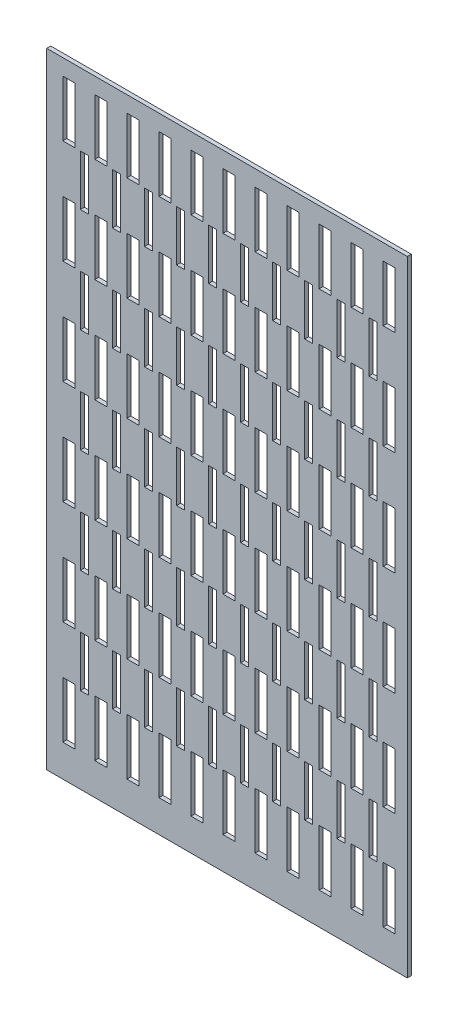
from build123d import *

# Parameters (mm, degrees)
SKETCH_1_W          = 45
SKETCH_1_H          = 78
EXTRUDE_1_DEPTH     = 0.5
SKETCH_2_W          = 1.5
SKETCH_2_H          = 7
SKETCH_2_W_2        = 1
SKETCH_2_H_2        = 6.326302659
CUT_EXTRUDE_1_DEPTH = 0.5


with BuildPart() as part:
    # 草图1 → 凸台-拉伸1 (new body)
    with BuildSketch(Plane.XY):
        with Locations((0, 39)):
            Rectangle(SKETCH_1_W, SKETCH_1_H)
    extrude(amount=EXTRUDE_1_DEPTH)

    # 草图2 → 切除-拉伸1 (cut)
    with BuildSketch(Plane.XY.offset(0.5)):
        with Locations((-19.75, 72.5)):
            Rectangle(SKETCH_2_W, SKETCH_2_H)
        with Locations((-15.75, 72.5)):
            Rectangle(SKETCH_2_W, SKETCH_2_H)
        with Locations((-11.75, 72.5)):
            Rectangle(SKETCH_2_W, SKETCH_2_H)
        with Locations((-7.75, 72.5)):
            Rectangle(SKETCH_2_W, SKETCH_2_H)
        with Locations((-3.75, 72.5)):
            Rectangle(SKETCH_2_W, SKETCH_2_H)
        with Locations((0.25, 72.5)):
            Rectangle(SKETCH_2_W, SKETCH_2_H)
        with Locations((4.25, 72.5)):
            Rectangle(SKETCH_2_W, SKETCH_2_H)
        with Locations((8.25, 72.5)):
            Rectangle(SKETCH_2_W, SKETCH_2_H)
        with Locations((12.25, 72.5)):
            Rectangle(SKETCH_2_W, SKETCH_2_H)
        with Locations((16.25, 72.5)):
            Rectangle(SKETCH_2_W, SKETCH_2_H)
        with Locations((20.25, 72.5)):
            Rectangle(SKETCH_2_W, SKETCH_2_H)
        with Locations((-19.75, 59.5)):
            Rectangle(SKETCH_2_W, SKETCH_2_H)
        with Locations((-15.75, 59.5)):
            Rectangle(SKETCH_2_W, SKETCH_2_H)
        with Locations((-11.75, 59.5)):
            Rectangle(SKETCH_2_W, SKETCH_2_H)
        with Locations((-7.75, 59.5)):
            Rectangle(SKETCH_2_W, SKETCH_2_H)
        with Locations((-3.75, 59.5)):
            Rectangle(SKETCH_2_W, SKETCH_2_H)
        with Locations((0.25, 59.5)):
            Rectangle(SKETCH_2_W, SKETCH_2_H)
        with Locations((4.25, 59.5)):
            Rectangle(SKETCH_2_W, SKETCH_2_H)
        with Locations((8.25, 59.5)):
            Rectangle(SKETCH_2_W, SKETCH_2_H)
        with Locations((12.25, 59.5)):
            Rectangle(SKETCH_2_W, SKETCH_2_H)
        with Locations((16.25, 59.5)):
            Rectangle(SKETCH_2_W, SKETCH_2_H)
        with Locations((20.25, 59.5)):
            Rectangle(SKETCH_2_W, SKETCH_2_H)
        with Locations((-19.75, 46.5)):
            Rectangle(SKETCH_2_W, SKETCH_2_H)
        with Locations((-15.75, 46.5)):
            Rectangle(SKETCH_2_W, SKETCH_2_H)
        with Locations((-11.75, 46.5)):
            Rectangle(SKETCH_2_W, SKETCH_2_H)
        with Locations((-7.75, 46.5)):
            Rectangle(SKETCH_2_W, SKETCH_2_H)
        with Locations((-3.75, 46.5)):
            Rectangle(SKETCH_2_W, SKETCH_2_H)
        with Locations((0.25, 46.5)):
            Rectangle(SKETCH_2_W, SKETCH_2_H)
        with Locations((4.25, 46.5)):
            Rectangle(SKETCH_2_W, SKETCH_2_H)
        with Locations((8.25, 46.5)):
            Rectangle(SKETCH_2_W, SKETCH_2_H)
        with Locations((12.25, 46.5)):
            Rectangle(SKETCH_2_W, SKETCH_2_H)
        with Locations((16.25, 46.5)):
            Rectangle(SKETCH_2_W, SKETCH_2_H)
        with Locations((20.25, 46.5)):
            Rectangle(SKETCH_2_W, SKETCH_2_H)
        with Locations((-19.75, 33.5)):
            Rectangle(SKETCH_2_W, SKETCH_2_H)
        with Locations((-15.75, 33.5)):
            Rectangle(SKETCH_2_W, SKETCH_2_H)
        with Locations((-11.75, 33.5)):
            Rectangle(SKETCH_2_W, SKETCH_2_H)
        with Locations((-7.75, 33.5)):
            Rectangle(SKETCH_2_W, SKETCH_2_H)
        with Locations((-3.75, 33.5)):
            Rectangle(SKETCH_2_W, SKETCH_2_H)
        with Locations((0.25, 33.5)):
            Rectangle(SKETCH_2_W, SKETCH_2_H)
        with Locations((4.25, 33.5)):
            Rectangle(SKETCH_2_W, SKETCH_2_H)
        with Locations((8.25, 33.5)):
            Rectangle(SKETCH_2_W, SKETCH_2_H)
        with Locations((12.25, 33.5)):
            Rectangle(SKETCH_2_W, SKETCH_2_H)
        with Locations((16.25, 33.5)):
            Rectangle(SKETCH_2_W, SKETCH_2_H)
        with Locations((20.25, 33.5)):
            Rectangle(SKETCH_2_W, SKETCH_2_H)
        with Locations((-19.75, 20.5)):
            Rectangle(SKETCH_2_W, SKETCH_2_H)
        with Locations((-15.75, 20.5)):
            Rectangle(SKETCH_2_W, SKETCH_2_H)
        with Locations((-11.75, 20.5)):
            Rectangle(SKETCH_2_W, SKETCH_2_H)
        with Locations((-7.75, 20.5)):
            Rectangle(SKETCH_2_W, SKETCH_2_H)
        with Locations((-3.75, 20.5)):
            Rectangle(SKETCH_2_W, SKETCH_2_H)
        with Locations((0.25, 20.5)):
            Rectangle(SKETCH_2_W, SKETCH_2_H)
        with Locations((4.25, 20.5)):
            Rectangle(SKETCH_2_W, SKETCH_2_H)
        with Locations((8.25, 20.5)):
            Rectangle(SKETCH_2_W, SKETCH_2_H)
        with Locations((12.25, 20.5)):
            Rectangle(SKETCH_2_W, SKETCH_2_H)
        with Locations((16.25, 20.5)):
            Rectangle(SKETCH_2_W, SKETCH_2_H)
        with Locations((20.25, 20.5)):
            Rectangle(SKETCH_2_W, SKETCH_2_H)
        with Locations((-19.75, 7.5)):
            Rectangle(SKETCH_2_W, SKETCH_2_H)
        with Locations((-15.75, 7.5)):
            Rectangle(SKETCH_2_W, SKETCH_2_H)
        with Locations((-11.75, 7.5)):
            Rectangle(SKETCH_2_W, SKETCH_2_H)
        with Locations((-7.75, 7.5)):
            Rectangle(SKETCH_2_W, SKETCH_2_H)
        with Locations((-3.75, 7.5)):
            Rectangle(SKETCH_2_W, SKETCH_2_H)
        with Locations((0.25, 7.5)):
            Rectangle(SKETCH_2_W, SKETCH_2_H)
        with Locations((4.25, 7.5)):
            Rectangle(SKETCH_2_W, SKETCH_2_H)
        with Locations((8.25, 7.5)):
            Rectangle(SKETCH_2_W, SKETCH_2_H)
        with Locations((12.25, 7.5)):
            Rectangle(SKETCH_2_W, SKETCH_2_H)
        with Locations((16.25, 7.5)):
            Rectangle(SKETCH_2_W, SKETCH_2_H)
        with Locations((20.25, 7.5)):
            Rectangle(SKETCH_2_W, SKETCH_2_H)
        with Locations((-13.8, 65.836848671)):
            Rectangle(SKETCH_2_W_2, SKETCH_2_H_2)
        with Locations((-17.8, 65.836848671)):
            Rectangle(SKETCH_2_W_2, SKETCH_2_H_2)
        with Locations((-9.8, 65.836848671)):
            Rectangle(SKETCH_2_W_2, SKETCH_2_H_2)
        with Locations((-5.8, 65.836848671)):
            Rectangle(SKETCH_2_W_2, SKETCH_2_H_2)
        with Locations((-1.8, 65.836848671)):
            Rectangle(SKETCH_2_W_2, SKETCH_2_H_2)
        with Locations((2.2, 65.836848671)):
            Rectangle(SKETCH_2_W_2, SKETCH_2_H_2)
        with Locations((6.2, 65.836848671)):
            Rectangle(SKETCH_2_W_2, SKETCH_2_H_2)
        with Locations((10.2, 65.836848671)):
            Rectangle(SKETCH_2_W_2, SKETCH_2_H_2)
        with Locations((14.2, 65.836848671)):
            Rectangle(SKETCH_2_W_2, SKETCH_2_H_2)
        with Locations((18.2, 65.836848671)):
            Rectangle(SKETCH_2_W_2, SKETCH_2_H_2)
        with Locations((-17.8, 52.836848671)):
            Rectangle(SKETCH_2_W_2, SKETCH_2_H_2)
        with Locations((-13.8, 52.836848671)):
            Rectangle(SKETCH_2_W_2, SKETCH_2_H_2)
        with Locations((-9.8, 52.836848671)):
            Rectangle(SKETCH_2_W_2, SKETCH_2_H_2)
        with Locations((-5.8, 52.836848671)):
            Rectangle(SKETCH_2_W_2, SKETCH_2_H_2)
        with Locations((-1.8, 52.836848671)):
            Rectangle(SKETCH_2_W_2, SKETCH_2_H_2)
        with Locations((2.2, 52.836848671)):
            Rectangle(SKETCH_2_W_2, SKETCH_2_H_2)
        with Locations((6.2, 52.836848671)):
            Rectangle(SKETCH_2_W_2, SKETCH_2_H_2)
        with Locations((10.2, 52.836848671)):
            Rectangle(SKETCH_2_W_2, SKETCH_2_H_2)
        with Locations((14.2, 52.836848671)):
            Rectangle(SKETCH_2_W_2, SKETCH_2_H_2)
        with Locations((18.2, 52.836848671)):
            Rectangle(SKETCH_2_W_2, SKETCH_2_H_2)
        with Locations((-17.8, 39.836848671)):
            Rectangle(SKETCH_2_W_2, SKETCH_2_H_2)
        with Locations((-13.8, 39.836848671)):
            Rectangle(SKETCH_2_W_2, SKETCH_2_H_2)
        with Locations((-9.8, 39.836848671)):
            Rectangle(SKETCH_2_W_2, SKETCH_2_H_2)
        with Locations((-5.8, 39.836848671)):
            Rectangle(SKETCH_2_W_2, SKETCH_2_H_2)
        with Locations((-1.8, 39.836848671)):
            Rectangle(SKETCH_2_W_2, SKETCH_2_H_2)
        with Locations((2.2, 39.836848671)):
            Rectangle(SKETCH_2_W_2, SKETCH_2_H_2)
        with Locations((6.2, 39.836848671)):
            Rectangle(SKETCH_2_W_2, SKETCH_2_H_2)
        with Locations((10.2, 39.836848671)):
            Rectangle(SKETCH_2_W_2, SKETCH_2_H_2)
        with Locations((14.2, 39.836848671)):
            Rectangle(SKETCH_2_W_2, SKETCH_2_H_2)
        with Locations((18.2, 39.836848671)):
            Rectangle(SKETCH_2_W_2, SKETCH_2_H_2)
        with Locations((-17.8, 26.836848671)):
            Rectangle(SKETCH_2_W_2, SKETCH_2_H_2)
        with Locations((-13.8, 26.836848671)):
            Rectangle(SKETCH_2_W_2, SKETCH_2_H_2)
        with Locations((-9.8, 26.836848671)):
            Rectangle(SKETCH_2_W_2, SKETCH_2_H_2)
        with Locations((-5.8, 26.836848671)):
            Rectangle(SKETCH_2_W_2, SKETCH_2_H_2)
        with Locations((-1.8, 26.836848671)):
            Rectangle(SKETCH_2_W_2, SKETCH_2_H_2)
        with Locations((2.2, 26.836848671)):
            Rectangle(SKETCH_2_W_2, SKETCH_2_H_2)
        with Locations((6.2, 26.836848671)):
            Rectangle(SKETCH_2_W_2, SKETCH_2_H_2)
        with Locations((10.2, 26.836848671)):
            Rectangle(SKETCH_2_W_2, SKETCH_2_H_2)
        with Locations((14.2, 26.836848671)):
            Rectangle(SKETCH_2_W_2, SKETCH_2_H_2)
        with Locations((18.2, 26.836848671)):
            Rectangle(SKETCH_2_W_2, SKETCH_2_H_2)
        with Locations((-17.8, 13.836848671)):
            Rectangle(SKETCH_2_W_2, SKETCH_2_H_2)
        with Locations((-13.8, 13.836848671)):
            Rectangle(SKETCH_2_W_2, SKETCH_2_H_2)
        with Locations((-9.8, 13.836848671)):
            Rectangle(SKETCH_2_W_2, SKETCH_2_H_2)
        with Locations((-5.8, 13.836848671)):
            Rectangle(SKETCH_2_W_2, SKETCH_2_H_2)
        with Locations((-1.8, 13.836848671)):
            Rectangle(SKETCH_2_W_2, SKETCH_2_H_2)
        with Locations((2.2, 13.836848671)):
            Rectangle(SKETCH_2_W_2, SKETCH_2_H_2)
        with Locations((6.2, 13.836848671)):
            Rectangle(SKETCH_2_W_2, SKETCH_2_H_2)
        with Locations((10.2, 13.836848671)):
            Rectangle(SKETCH_2_W_2, SKETCH_2_H_2)
        with Locations((14.2, 13.836848671)):
            Rectangle(SKETCH_2_W_2, SKETCH_2_H_2)
        with Locations((18.2, 13.836848671)):
            Rectangle(SKETCH_2_W_2, SKETCH_2_H_2)
    extrude(amount=-CUT_EXTRUDE_1_DEPTH, mode=Mode.SUBTRACT)


solid = part.part
